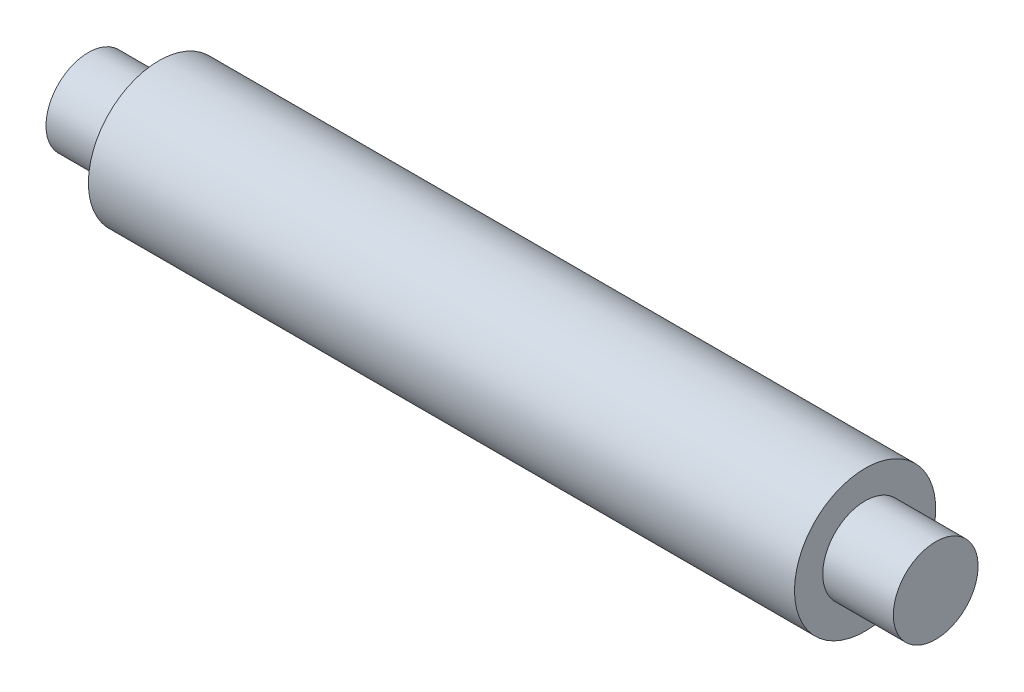
from build123d import *

# Parameters (mm, degrees)
SKETCH_1_W = 10
SKETCH_1_H = 6


with BuildPart() as part:
    # 草圖1 → 迴轉1 (revolve)
    with BuildSketch(Plane.XY, mode=Mode.PRIVATE) as revolve_1_sk:
        with Locations((115, 3)):
            Rectangle(SKETCH_1_W, SKETCH_1_H)
        with Locations((5, 3)):
            Rectangle(SKETCH_1_W, SKETCH_1_H)
        Polygon((10, 0), (110, 0), (110, 6), (110, 10), (10, 10), (10, 6), align=None)
    revolve(revolve_1_sk.sketch.rotate(Axis((10, 0, 0), (1, 0, 0)), 90), axis=Axis((10, 0, 0), (1, 0, 0)))


solid = part.part
